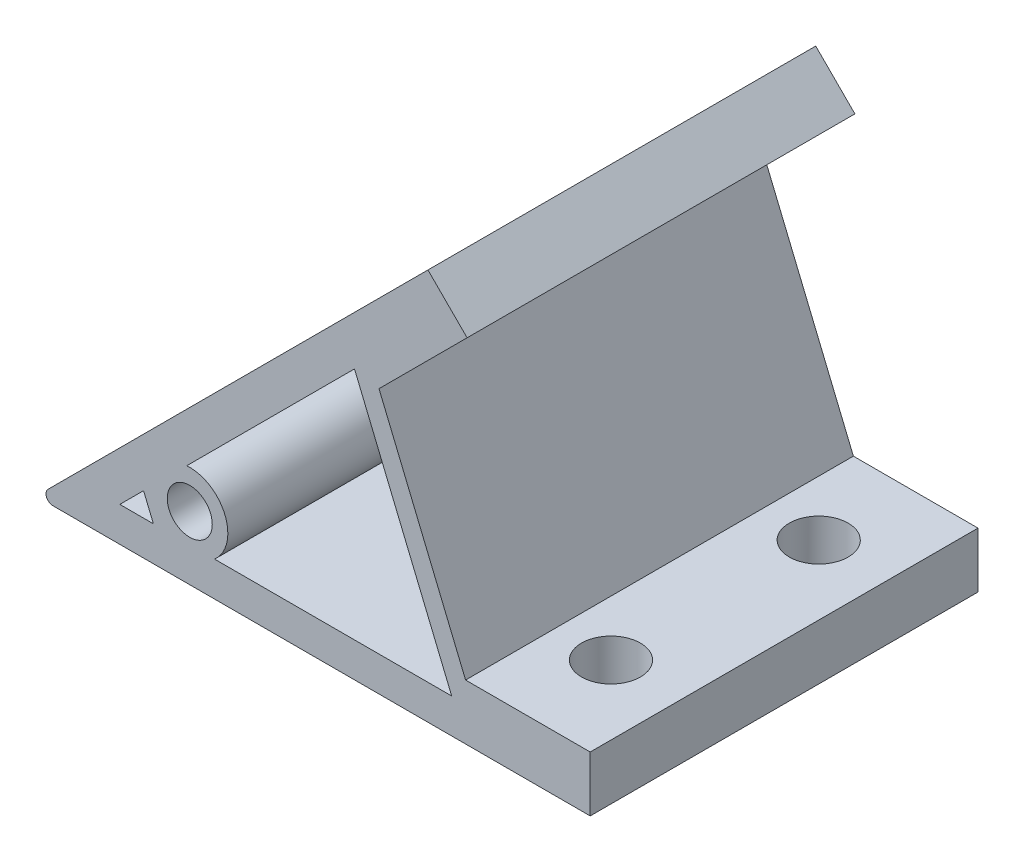
from build123d import *

# Parameters (mm, degrees)
SKETCH_1_R          = 3.25
EXTRUDE_1_DEPTH     = 28
SKETCH_3_R          = 4.25
CUT_EXTRUDE_1_DEPTH = 17


with BuildPart() as part:
    # 草图1 → 凸台-拉伸1 (new, symmetric)
    with BuildSketch(Plane.XY):
        with BuildLine():
            Line((-77.585786438, 0), (0, 0))
            Line((0, 0), (0, 8))
            Line((0, 8), (-17.995464086, 8))
            Line((-17.995464086, 8), (-30.499317942, 38.186973559))
            Line((-30.499317942, 38.186973559), (-17.774603256, 50.911688245))
            Line((-17.774603256, 50.911688245), (-23.431457505, 56.568542495))
            Line((-23.431457505, 56.568542495), (-78.292893219, 1.707106781))
            ThreePointArc((-78.292893219, 1.707106781), (-78.50966597, 0.617316568), (-77.585786438, 0))
        make_face()
        with Locations((-57.82689122, 9.184402377)):
            Circle(SKETCH_1_R, mode=Mode.SUBTRACT)
        Polygon((-67.928932188, 5), (-63.07447047, 5), (-64.496309389, 8.4326228), align=None, mode=Mode.SUBTRACT)
        with BuildLine():
            Line((-54.257468753, 5), (-20, 5))
            Line((-20, 5), (-34.038059223, 38.890872965))
            Line((-34.038059223, 38.890872965), (-58.261747684, 14.667184504))
            ThreePointArc((-58.261747684, 14.667184504), (-52.745553791, 11.289161255), (-54.257468753, 5))
        make_face(mode=Mode.SUBTRACT)
    extrude(amount=EXTRUDE_1_DEPTH, both=True)

    # 草图3 → 切除-拉伸1 (cut)
    with BuildSketch(Plane(origin=(0, 8, 0), x_dir=(1, 0, 0), z_dir=(0, 1, 0))):
        with Locations(Location((-10, -15, 0), (0, 0, 180))):
            Circle(SKETCH_3_R)
        with Locations(Location((-10, 15, 0), (0, 0, 270))):
            Circle(SKETCH_3_R)
    cut_extrude_1 = extrude(amount=-CUT_EXTRUDE_1_DEPTH, mode=Mode.SUBTRACT)

    # 镜向1: 切除-拉伸1 across plane
    add(cut_extrude_1.mirror(Plane(origin=(-11.715728753, 28.284271247, 0), x_dir=(0, 0, 1), z_dir=(-0.3826834323650881, 0.9238795325112875, 0))), mode=Mode.SUBTRACT)


solid = part.part
